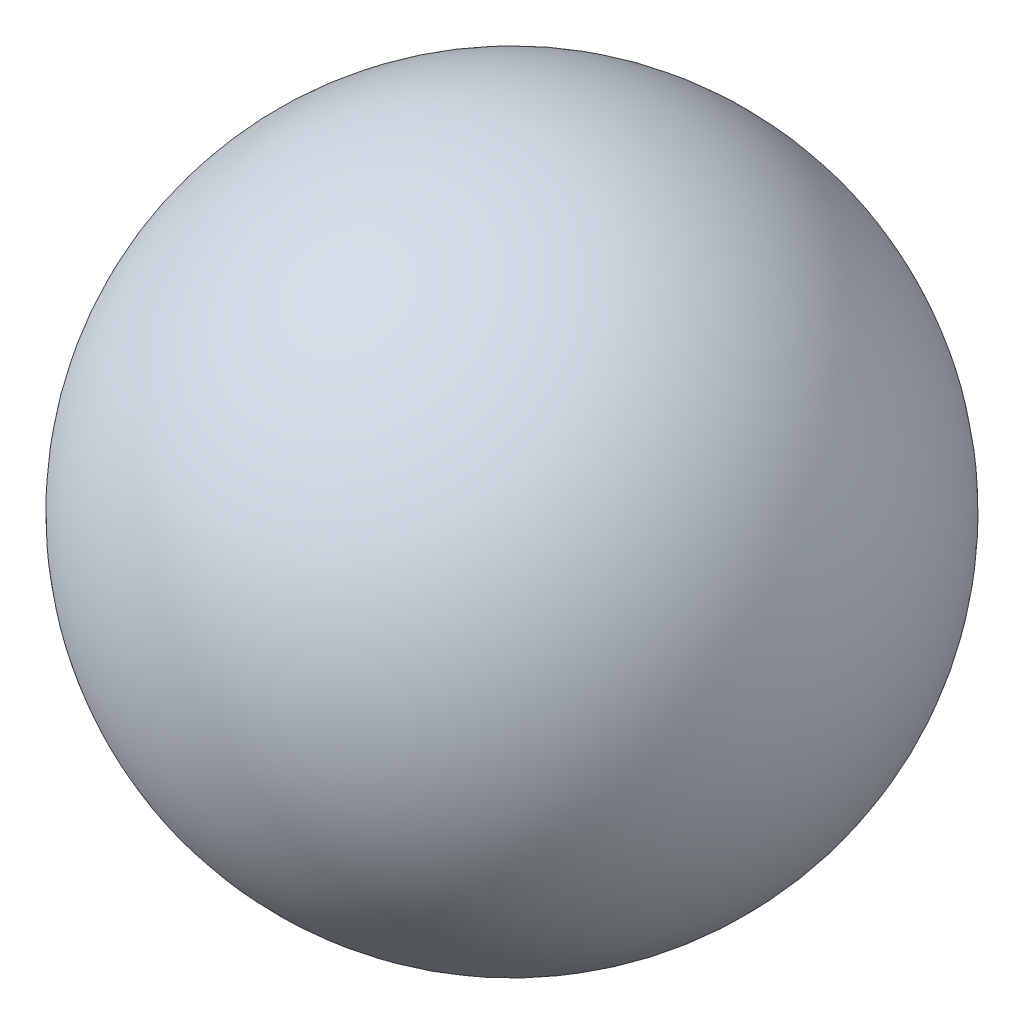
from build123d import *


with BuildPart() as part:
    # Sketch1 → Revolve1 (revolve)
    with BuildSketch(Plane(origin=(0, 0, 0), x_dir=(1, 0, 0), z_dir=(0, 1, 0))):
        with BuildLine():
            Line((0, 8), (0, -8))
            ThreePointArc((0, -8), (-8, 0), (0, 8))
        make_face()
    revolve(axis=Axis((0, 0, -8), (0, 0, 1)))


solid = part.part
